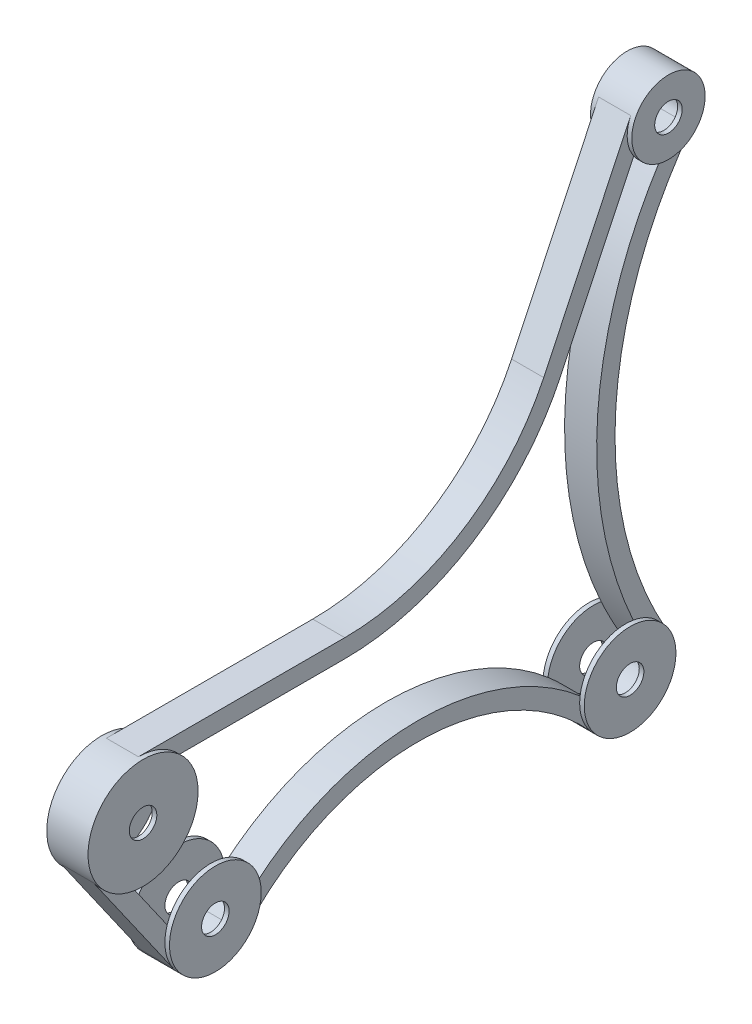
from build123d import *

# Parameters (mm, degrees)
BOSS_EXTRUDE1_DEPTH = 44.449999999999996
BOSS_EXTRUDE2_START = 12.7
SKETCH2_R           = 127.00000000000026
SKETCH2_R_2         = 38.09999999999998
SKETCH2_R_3         = 152.39999999999995
SKETCH2_R_4         = 38.10000000000004
SKETCH2_R_5         = 127.00000000000524
SKETCH2_R_6         = 38.10000000000009
SKETCH2_R_7         = 101.59999999999945
SKETCH2_R_8         = 38.10000000000007
BOSS_EXTRUDE2_DEPTH = 12.7


with BuildPart() as part:
    # Sketch1 → Boss-Extrude1 (new, symmetric)
    with BuildSketch(Plane(origin=(0, 0, 0), x_dir=(0, 0, -1), z_dir=(1, 0, 0))):
        with BuildLine():
            Line((292.75767615040746, -1.5786e-13), (864.2576761504075, -4.1113e-13))
            ThreePointArc((864.2576761504075, -4.1113e-13), (1190.1025822900356, 94.39396631749571), (1415.036093761449, 348.34285714285653))
            Line((1415.036093761449, 348.34285714285653), (1656.0016514662793, 856.3428571428565))
            ThreePointArc((1656.0016514662793, 856.3428571428565), (1800.5110136275975, 899.6556499579777), (1828.8000000000002, 751.4710116727003))
            ThreePointArc((1828.8000000000002, 751.4710116727003), (1614.8079841790877, 177.34138113633213), (1751.9712010597207, -419.8216346557389))
            ThreePointArc((1751.9712010597207, -419.8216346557389), (1715.4290562941019, -585.9160522435095), (1546.4465674603723, -566.7430930182793))
            ThreePointArc((1546.4465674603723, -566.7430930182793), (1067.265507093057, -350.8585161091587), (588.0844467257416, -566.7430930182793))
            ThreePointArc((588.0844467257416, -566.7430930182793), (485.76498042432655, -609.3961073308187), (388.92622108801334, -555.4442074165836))
            Line((388.92622108801334, -555.4442074165836), (167.91890460076553, -239.8130488999002))
            ThreePointArc((167.91890460076553, -239.8130488999002), (157.5772251740463, -82.02951134298137), (292.75767615040746, -1.5786e-13))
        make_face()
        with BuildLine():
            Line((292.7576761504074, -50.8), (864.2576761504075, -50.8))
            ThreePointArc((864.2576761504075, -50.8), (1217.2563244683374, 51.46013017728751), (1460.9342952290358, 326.571428571428))
            Line((1460.9342952290358, 326.571428571428), (1701.8998529338662, 834.571428571428))
            ThreePointArc((1701.8998529338662, 834.571428571428), (1774.1545340145256, 856.2278249789883), (1788.2990272007264, 782.1355058363492))
            ThreePointArc((1788.2990272007264, 782.1355058363492), (1564.1169153883338, 180.66636908396612), (1707.8117140251866, -444.93298079344424))
            ThreePointArc((1707.8117140251866, -444.93298079344424), (1685.8864271658267, -544.589631346108), (1584.4969338655828, -533.0858558109679))
            ThreePointArc((1584.4969338655828, -533.0858558109679), (1067.265507093057, -300.058516109159), (550.0340803205312, -533.0858558109682))
            ThreePointArc((550.0340803205312, -533.0858558109682), (488.6424005396823, -558.6776643984912), (430.53914493789466, -526.306524449951))
            Line((430.53914493789466, -526.306524449951), (209.53182845064617, -210.6753659332667))
            ThreePointArc((209.53182845064617, -210.6753659332667), (202.6373754995001, -105.48634089532098), (292.7576761504074, -50.8))
        make_face(mode=Mode.SUBTRACT)
    extrude(amount=BOSS_EXTRUDE1_DEPTH, both=True)

    # Sketch2 → Boss-Extrude2 (add)
    # profile 1 of 4: a face of its own
    with BuildSketch(Plane(origin=(44.449999999999996, 0, 0), x_dir=(0, 0, -1), z_dir=(1, 0, 0)).offset(BOSS_EXTRUDE2_START)):
        with Locations((492.95853071271534, -482.60000000000036)):
            Circle(SKETCH2_R)
        with Locations((492.95853071271534, -482.60000000000036)):
            Circle(SKETCH2_R_2, mode=Mode.SUBTRACT)
    # profile 2 of 4: a face of its own
    with BuildSketch(Plane(origin=(44.449999999999996, 0, 0), x_dir=(0, 0, -1), z_dir=(1, 0, 0)).offset(BOSS_EXTRUDE2_START)):
        with Locations((292.7576761504074, -152.40000000000018)):
            Circle(SKETCH2_R_3)
        with Locations((292.7576761504074, -152.40000000000018)):
            Circle(SKETCH2_R_4, mode=Mode.SUBTRACT)
    # profile 3 of 4: a face of its own
    with BuildSketch(Plane(origin=(44.449999999999996, 0, 0), x_dir=(0, 0, -1), z_dir=(1, 0, 0)).offset(BOSS_EXTRUDE2_START)):
        with Locations((1641.5724834734083, -482.6000000000008)):
            Circle(SKETCH2_R_5)
        with Locations((1641.5724834734083, -482.6000000000008)):
            Circle(SKETCH2_R_6, mode=Mode.SUBTRACT)
    # profile 4 of 4: a face of its own
    with BuildSketch(Plane(origin=(44.449999999999996, 0, 0), x_dir=(0, 0, -1), z_dir=(1, 0, 0)).offset(BOSS_EXTRUDE2_START)):
        with Locations((1747.798054401453, 812.7999999999992)):
            Circle(SKETCH2_R_7)
        with Locations((1747.798054401453, 812.7999999999992)):
            Circle(SKETCH2_R_8, mode=Mode.SUBTRACT)
    boss_extrude2 = extrude(amount=-BOSS_EXTRUDE2_DEPTH)

    # Mirror1: Boss-Extrude2 across plane
    add(boss_extrude2.mirror(Plane(origin=(0, 0, 0), x_dir=(0, 0, 1), z_dir=(1, 0, 0))))


solid = part.part
